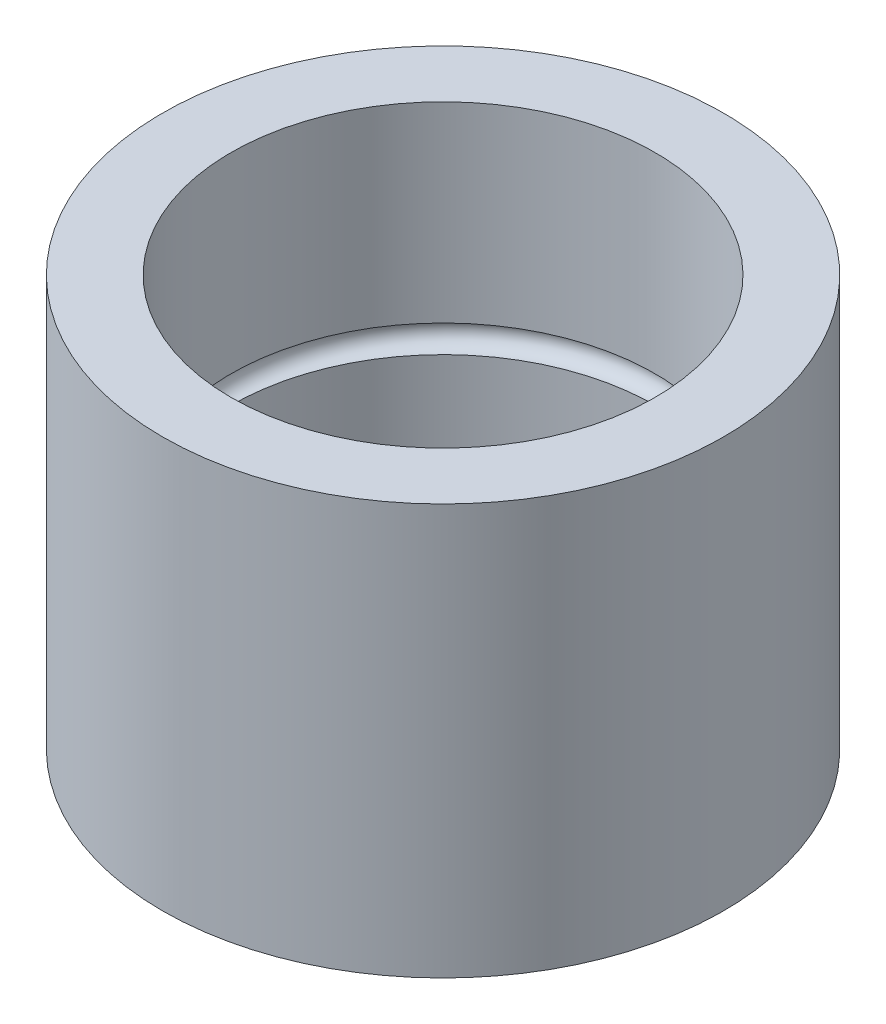
from build123d import *


with BuildPart() as part:
    # Esboço1 → Revolução1 (revolve)
    with BuildSketch(Plane.XY, mode=Mode.PRIVATE) as revolu_o1_sk:
        with BuildLine():
            Line((-15.5, -1), (-15.5, -15))
            Line((-15.5, -15), (-20.5, -15))
            Line((-20.5, -15), (-20.5, 15))
            Line((-20.5, 15), (-15.5, 15))
            Line((-15.5, 15), (-15.5, 1))
            ThreePointArc((-15.5, 1), (-16.5, 0), (-15.5, -1))
        make_face()
    revolve(revolu_o1_sk.sketch.rotate(Axis((0, 15, 0), (0, -1, 0)), 270), axis=Axis((0, 15, 0), (0, -1, 0)))


solid = part.part
